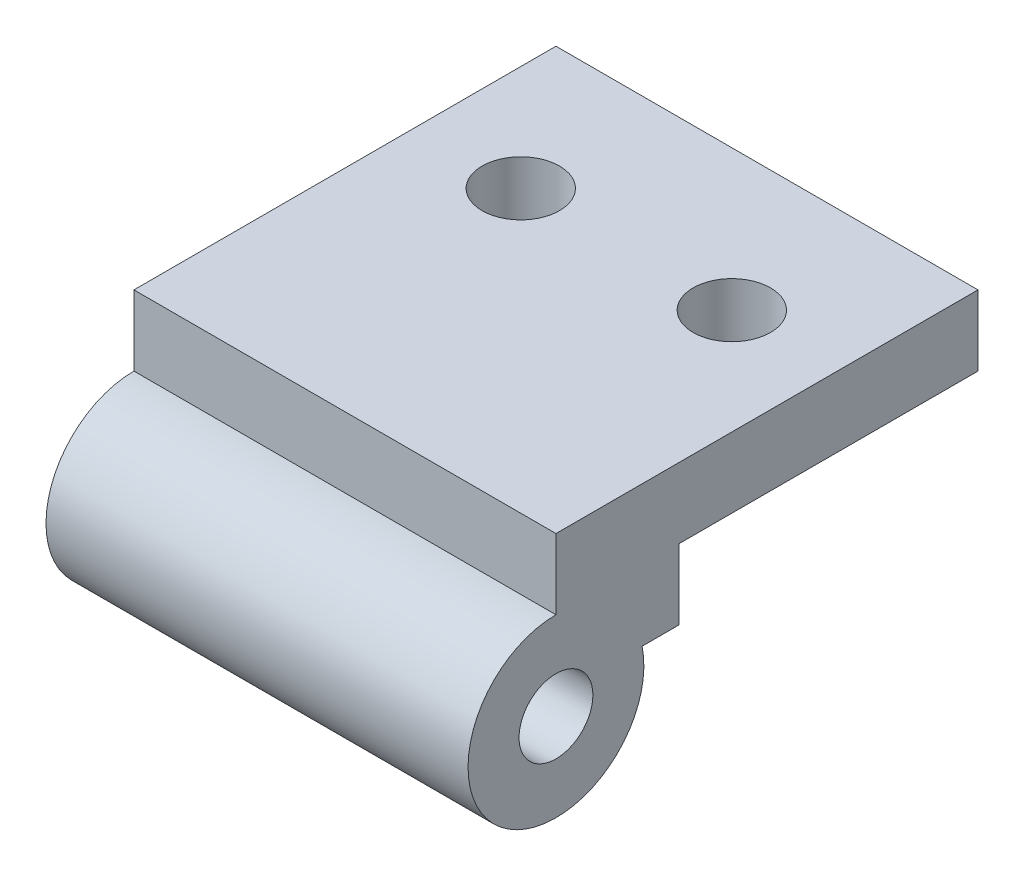
from build123d import *

# Parameters (mm, degrees)
SKETCH_1_W                      = 9.5
SKETCH_1_H                      = 13.25
EXTRUDE_1_DEPTH                 = 2
EXTRUDE_2_DEPTH                 = 12
PATTERN_LINEAR_1_COUNT          = 5
PATTERN_LINEAR_1_PITCH          = 22
HOLE_WIZARD_2_2_2_2_1_D         = 2.1
EXTRUDE_3_DEPTH                 = 12
SKETCH_7_W                      = 1.05
SKETCH_7_H                      = 15
EXTRUDE_4_DEPTH                 = 110
HOLE_WIZARD_2_0_2_2_D           = 2
HOLE_WIZARD_2_0_2_2_ON_FACE_2_D = 2
CUT_EXTRUDE_1_DEPTH             = 135.480746763
CUT_EXTRUDE_1_DEPTH_BACK        = 135.480746763
SKETCH_14_W                     = 52.846717088
SKETCH_14_H                     = 8
SKETCH19_W                      = 12
SKETCH19_H                      = 12
EXTRUDE23_DEPTH                 = 2
SKETCH20_R                      = 1.1
EXTRUDE24_DEPTH                 = 2
CUT_EXTRUDE_2_DEPTH             = 22
CUT_EXTRUDE_2_DEPTH_BACK        = 24
SKETCH_15_W                     = 124.248356878
SKETCH_15_H                     = 108.553418936
CUT_EXTRUDE_START               = -90
CUT_EXTRUDE_3_DEPTH             = 90
CUT_EXTRUDE_4_DEPTH             = 18
CUT_EXTRUDE_4_DEPTH_BACK        = 16
SKETCH_18_W                     = 34.927969389
SKETCH_18_H                     = 20.970488767


with BuildPart() as part:
    # 草图1 → 凸台-拉伸1 (new body)
    with BuildSketch(Plane(origin=(0, 0, 0), x_dir=(1, 0, 0), z_dir=(0, 1, 0))):
        Polygon((21.5, 0), (21.5, 110), (9, 110), (0, 101), (0, 0), align=None)
        Polygon((19.121320344, 101), (4.242640687, 101), (8.121320344, 104.878679656), (19.121320344, 104.878679656), align=None, mode=Mode.SUBTRACT)
        with Locations((10.75, 12.625)):
            Rectangle(SKETCH_1_W, SKETCH_1_H, mode=Mode.SUBTRACT)
        with Locations((10.75, 37.875)):
            Rectangle(SKETCH_1_W, SKETCH_1_H, mode=Mode.SUBTRACT)
        with Locations((10.75, 63.125)):
            Rectangle(SKETCH_1_W, SKETCH_1_H, mode=Mode.SUBTRACT)
        with Locations((10.75, 88.375)):
            Rectangle(SKETCH_1_W, SKETCH_1_H, mode=Mode.SUBTRACT)
    extrude(amount=EXTRUDE_1_DEPTH)

    # 草图2 → 凸台-拉伸2 (add)
    with BuildSketch(Plane(origin=(0, 0, -101), x_dir=(-1, 0, 0), z_dir=(0, 0, -1))):
        with BuildLine():
            Line((0, 2), (0, 0))
            Line((0, 0), (3.5, 0))
            ThreePointArc((3.5, 0), (5.08113883, 4.436491673), (1.050510257, 2))
            Line((1.050510257, 2), (0, 2))
        make_face()
    extrude_2 = extrude(amount=-EXTRUDE_2_DEPTH)

    # 阵列(线性)1: 凸台-拉伸2 ×5
    with Locations(*[(0, 0, i * PATTERN_LINEAR_1_PITCH) for i in range(1, PATTERN_LINEAR_1_COUNT)]):
        add(extrude_2)

    # Ø2.2 (2.2) 直径孔1 (through all)
    with Locations(Plane(origin=(0, 0, -101), x_dir=(-1, 0, 0), z_dir=(0, 0, -1))):
        with Locations((3.5, 2.5)):
            Hole(HOLE_WIZARD_2_2_2_2_1_D / 2)

    # 草图5 → 凸台-拉伸3 (add)
    with BuildSketch(Plane(origin=(9, 0, 0), x_dir=(0, 0, -1), z_dir=(1, 0, 0))):
        with BuildLine():
            Line((108.949489743, 0), (110, 0))
            Line((110, 0), (110, 2))
            Line((110, 2), (106.5, 2))
            ThreePointArc((106.5, 2), (104.91886117, -2.436491673), (108.949489743, 0))
        make_face()
    extrude(amount=-EXTRUDE_3_DEPTH)

    # 草图7 → Ø2.2 (2.2) 直径孔2 (revolve, cut)
    with BuildSketch(Plane(origin=(9, -0.5, -106.5), x_dir=(0, 0, -1), z_dir=(0, 1, 0))):
        with Locations((0.525, 7.5)):
            Rectangle(SKETCH_7_W, SKETCH_7_H)
    revolve(axis=Axis((15.35, -0.5, -106.5), (-1, 0, 0)), mode=Mode.SUBTRACT)

    # 草图8 → 凸台-拉伸4 (add)
    with BuildSketch(Plane.XY):
        with BuildLine():
            ThreePointArc((31.5, 0), (34.178784027, 0.532843272), (36.449747468, 2.050252532))
            Line((36.449747468, 2.050252532), (39.577164466, 5.17766953))
            ThreePointArc((39.577164466, 5.17766953), (57.254833996, 12.5), (74.932503526, 5.17766953))
            Line((74.932503526, 5.17766953), (76.346717088, 6.591883092))
            ThreePointArc((76.346717088, 6.591883092), (57.254833996, 14.5), (38.162950904, 6.591883092))
            Line((38.162950904, 6.591883092), (35.035533906, 3.464466094))
            ThreePointArc((35.035533906, 3.464466094), (33.413417162, 2.380602337), (31.5, 2))
            Line((31.5, 2), (21.5, 2))
            Line((21.5, 2), (21.5, 0))
            Line((21.5, 0), (31.5, 0))
        make_face()
    extrude(amount=-EXTRUDE_4_DEPTH)

    # Ø2.0 (2) 直径孔2 (through all)
    with Locations(Plane(origin=(66.489377866, 12.871700761, -5), x_dir=(0.939692620786, -0.342020143326, 0), z_dir=(0.342020143326, 0.939692620786, 0))):
        with Locations((0, 0)):
            Hole(HOLE_WIZARD_2_0_2_2_D / 2)

    # Ø2.0 (2) 直径孔2 on face 2 (through all)
    with Locations(Plane(origin=(66.489377866, 12.871700761, -52), x_dir=(0.939692711209, -0.342019894889, 0), z_dir=(0.342019894889, 0.939692711209, 0))):
        with Locations((0, 0)):
            Hole(HOLE_WIZARD_2_0_2_2_ON_FACE_2_D / 2)

    # 草图14 → 切除-拉伸1 (cut, two sides: drawn at the far end of the back side and taken through both)
    with BuildSketch(Plane(origin=(0, 2, 0), x_dir=(1, 0, 0), z_dir=(0, 1, 0)).offset(-CUT_EXTRUDE_1_DEPTH_BACK)):
        with BuildLine():
            add(Edge.make_bspline(
                [(65.543349365, 5), (65.543349365, 4.867858182), (65.568139282, 4.738193315), (65.663651177, 4.49599396), (65.734288369, 4.385069362), (65.909329104, 4.20058787), (66.014984918, 4.126085586), (66.242291721, 4.026337096), (66.366299142, 4.000069682), (66.611454679, 3.999930602), (66.734292904, 4.025809235), (66.960669981, 4.125923854), (67.063423157, 4.199243917), (67.237262204, 4.385832013), (67.305425299, 4.495895945), (67.398649167, 4.738239585), (67.422691544, 4.869119898), (67.422777552, 5.130169285), (67.398544475, 5.261724961), (67.306168595, 5.502477284), (67.237041074, 5.614131138), (67.065581718, 5.798710334), (66.962099904, 5.873181003), (66.736029766, 5.973681753), (66.61428089, 5.999865952), (66.366377399, 6.000133023), (66.24402893, 5.974291959), (66.014886358, 5.874003493), (65.90992169, 5.799906628), (65.647004042, 5.52319771), (65.543349365, 5.264283637), (65.543349365, 5)],
                knots=[0, 0, 0, 0, 0.0625, 0.0625, 0.125, 0.125, 0.1875, 0.1875, 0.25, 0.25, 0.3125, 0.3125, 0.375, 0.375, 0.4375, 0.4375, 0.5, 0.5, 0.5625, 0.5625, 0.625, 0.625, 0.6875, 0.6875, 0.75, 0.75, 0.8125, 0.8125, 0.875, 0.875, 1, 1, 1, 1], degree=3))
        make_face()
        with Locations((46.923358544, 14)):
            Rectangle(SKETCH_14_W, SKETCH_14_H)
        with Locations((46.923358544, 61)):
            Rectangle(SKETCH_14_W, SKETCH_14_H)
    extrude(amount=CUT_EXTRUDE_1_DEPTH + CUT_EXTRUDE_1_DEPTH_BACK, mode=Mode.SUBTRACT)

    # Sketch19 → Extrude23 (add)
    with BuildSketch(Plane(origin=(0, 2, 0), x_dir=(1, 0, 0), z_dir=(0, 1, 0))):
        with Locations((3, 112.5)):
            Rectangle(SKETCH19_W, SKETCH19_H)
    extrude(amount=EXTRUDE23_DEPTH)

    # Sketch20 → Extrude24 (cut)
    with BuildSketch(Plane(origin=(0, 2, 0), x_dir=(-1, 0, 0), z_dir=(0, -1, 0))):
        with Locations(Location((-6, 114.5, 0), (0, 0, 90))):
            Circle(SKETCH20_R)
        with Locations(Location((0, 114.5, 0), (0, 0, 270))):
            Circle(SKETCH20_R)
    extrude(amount=-EXTRUDE24_DEPTH, mode=Mode.SUBTRACT)

    # 草图15 → 切除-拉伸2 (cut, two sides: drawn at the far end of the back side and taken through both)
    with BuildSketch(Plane(origin=(0, 2, 0), x_dir=(1, 0, 0), z_dir=(0, 1, 0)).offset(-CUT_EXTRUDE_2_DEPTH_BACK)):
        with Locations((56.124178439, 46.723290532)):
            Rectangle(SKETCH_15_W, SKETCH_15_H)
    extrude(amount=CUT_EXTRUDE_2_DEPTH + CUT_EXTRUDE_2_DEPTH_BACK, mode=Mode.SUBTRACT)

    # 草图17 → 切除-拉伸3 (cut)
    with BuildSketch(Plane.ZY.offset(3).offset(CUT_EXTRUDE_START)):
        with BuildLine():
            Line((-106.5, 2), (-106.5, 4))
            Line((-106.5, 4), (-110, 4))
            Line((-110, 4), (-110, 14.5))
            Line((-110, 14.5), (-101, 14.5))
            Line((-101, 14.5), (-101, 0))
            Line((-101, 0), (-104.050510257, 0))
            ThreePointArc((-104.050510257, 0), (-104.91886117, 1.436491673), (-106.5, 2))
        make_face()
    extrude(amount=CUT_EXTRUDE_3_DEPTH, mode=Mode.SUBTRACT)

    # 草图18 → 切除-拉伸4 (cut, two sides: drawn at the far end of the back side and taken through both)
    with BuildSketch(Plane(origin=(0, 4, 0), x_dir=(1, 0, 0), z_dir=(0, 1, 0)).offset(-CUT_EXTRUDE_4_DEPTH_BACK)):
        with Locations((26.463984695, 108.014755617)):
            Rectangle(SKETCH_18_W, SKETCH_18_H)
    extrude(amount=CUT_EXTRUDE_4_DEPTH + CUT_EXTRUDE_4_DEPTH_BACK, mode=Mode.SUBTRACT)


solid = part.part
